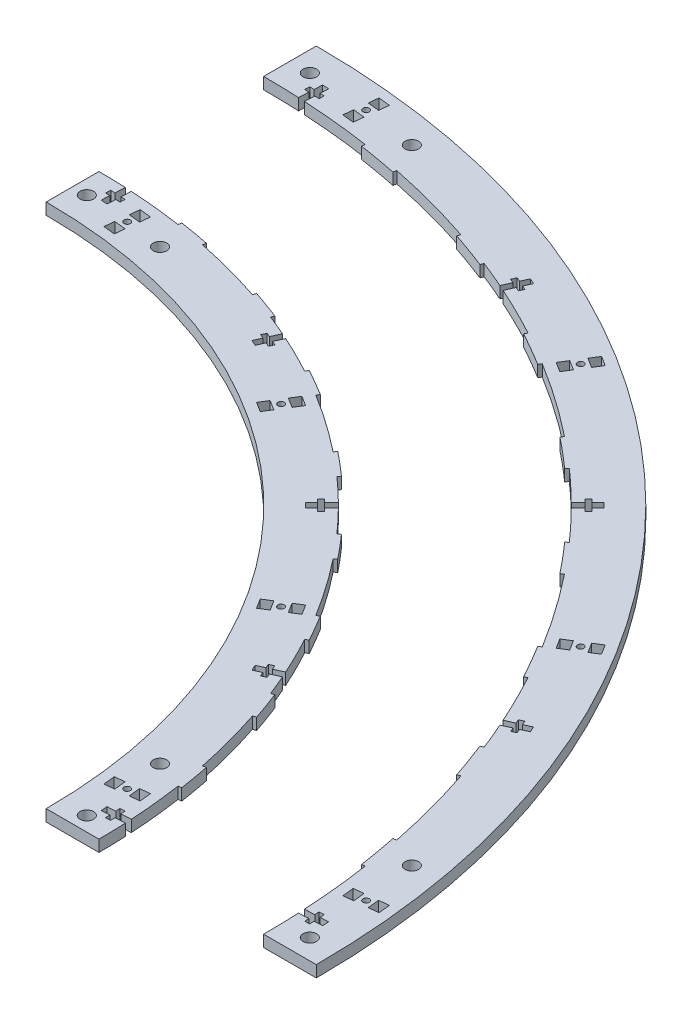
from build123d import *

# Parameters (mm, degrees)
BOSS_EXTRUDE1_DEPTH = 5.588
CUT_EXTRUDE2_DEPTH  = 543.234577659
CIRPATTERN1_COUNT   = 36
SKETCH8_R           = 1.524
CUT_EXTRUDE3_DEPTH  = 543.234577659
CIRPATTERN3_COUNT   = 4
CIRPATTERN3_ANGLE   = 78
SKETCH11_R          = 356.409886184
SKETCH11_R_2        = 280.209886184
CUT_EXTRUDE7_DEPTH  = 543.234577659
CUT_EXTRUDE16_DEPTH = 10
CUT_EXTRUDE17_DEPTH = 10
CIRPATTERN9_COUNT   = 5
CIRPATTERN9_ANGLE   = 84
CIRPATTERN11_COUNT  = 5
CIRPATTERN11_ANGLE  = 84
CUT_EXTRUDE14_DEPTH = 543.234577659
SKETCH14_R          = 3.2639
CUT_EXTRUDE18_DEPTH = 543.234577659


with BuildPart() as part:
    # Sketch2 → Boss-Extrude1 (new body)
    with BuildSketch(Plane(origin=(0, 0, 0), x_dir=(1, 0, 0), z_dir=(0, 1, 0))):
        with BuildLine():
            Line((0, 383.397386184), (0, 253.222386184))
            ThreePointArc((0, 253.222386184), (179.055266419, 179.055266419), (253.222386184, 0))
            Line((253.222386184, 0), (383.397386184, 0))
            ThreePointArc((383.397386184, 0), (271.10289166, 271.10289166), (0, 383.397386184))
        make_face()
    extrude(amount=BOSS_EXTRUDE1_DEPTH)

    # Sketch3 → Cut-Extrude2 (cut, through all)
    with BuildSketch(Plane(origin=(0, 0, 0), x_dir=(1, 0, 0), z_dir=(0, 1, 0))):
        with BuildLine():
            Line((277.132022507, 41.41765827), (275.561959824, 41.183010829))
            ThreePointArc((275.561959824, 41.183010829), (277.562143886, 24.283541014), (278.526909251, 7.293483801))
            Line((278.526909251, 7.293483801), (280.113865254, 7.335039706))
            ThreePointArc((280.113865254, 7.335039706), (279.143602969, 24.421900756), (277.132022507, 41.41765827))
        make_face()
        with BuildLine():
            Line((354.065093978, 52.915382838), (352.495031295, 52.680735398))
            ThreePointArc((352.495031295, 52.680735398), (355.053638964, 31.063168353), (356.287753417, 9.329723167))
            Line((356.287753417, 9.329723167), (357.874709421, 9.371279072))
            ThreePointArc((357.874709421, 9.371279072), (356.635098047, 31.201528095), (354.065093978, 52.915382838))
        make_face()
    cut_extrude2 = extrude(amount=CUT_EXTRUDE2_DEPTH, mode=Mode.SUBTRACT)

    # CirPattern1: Cut-Extrude2 ×36 about axis
    cirpattern1_axis = Axis((0, 0, 0), (0, 1, 0))
    for i in range(1, CIRPATTERN1_COUNT):
        add(cut_extrude2.rotate(cirpattern1_axis, i * 360 / CIRPATTERN1_COUNT), mode=Mode.SUBTRACT)

    # Sketch8 → Cut-Extrude3 (cut, through all)
    with BuildSketch(Plane(origin=(0, 0, 0), x_dir=(1, 0, 0), z_dir=(0, 1, 0))):
        with Locations((264.465635528, 27.796458376)):
            Circle(SKETCH8_R)
        with Locations((368.666667116, 38.748428115)):
            Circle(SKETCH8_R)
        Polygon((256.86367051, 24.188069523), (261.600081037, 24.68588633), (261.015975984, 30.243274681), (256.279565458, 29.745457875), align=None)
        Polygon((361.064702097, 35.140039262), (365.801112624, 35.637856069), (365.217007571, 41.19524442), (360.480597045, 40.697427614), align=None)
        Polygon((267.915295073, 25.349642071), (272.651705599, 25.847458878), (272.067600546, 31.404847229), (267.33119002, 30.907030423), align=None)
        Polygon((372.11632666, 36.30161181), (376.852737186, 36.799428617), (376.268632134, 42.356816968), (371.532221607, 41.859000162), align=None)
    cut_extrude3 = extrude(amount=CUT_EXTRUDE3_DEPTH, mode=Mode.SUBTRACT)

    # CirPattern3: Cut-Extrude3 ×4 about axis
    cirpattern3_axis = Axis((0, 0, 0), (0, 1, 0))
    for i in range(1, CIRPATTERN3_COUNT):
        add(cut_extrude3.rotate(cirpattern3_axis, i * CIRPATTERN3_ANGLE / (CIRPATTERN3_COUNT - 1)), mode=Mode.SUBTRACT)

    # Sketch11 → Cut-Extrude7 (cut, through all)
    with BuildSketch(Plane(origin=(0, 0, 0), x_dir=(1, 0, 0), z_dir=(0, 1, 0))):
        Circle(SKETCH11_R)
        Circle(SKETCH11_R_2, mode=Mode.SUBTRACT)
    extrude(amount=CUT_EXTRUDE7_DEPTH, mode=Mode.SUBTRACT)


with BuildPart() as cut_extrude7_piece_1:
    # of the separate pieces the step leaves, piece 1, a body of its own (cut_extrude7_pieces)
    add(part.part.solids().sort_by_distance((0, 0, -383.397386184))[0])

    # Sketch12 → Cut-Extrude16 (cut)
    with BuildSketch(Plane(origin=(0, 0, 0), x_dir=(1, 0, 0), z_dir=(0, 1, 0))):
        Polygon((362.451355257, 15.324065158), (364.829341837, 15.448690154), (364.717229101, 17.587928588), (368.680540067, 17.795636915), (368.521020073, 20.839459736), (364.557709107, 20.63175141), (364.445596371, 22.770989844), (362.067609791, 22.646364848), (362.179722527, 20.507126414), (355.838424981, 20.174793092), (355.997944976, 17.13097027), (362.339242522, 17.463303592), align=None)
    cut_extrude16 = extrude(amount=CUT_EXTRUDE16_DEPTH, mode=Mode.SUBTRACT)

    # CirPattern9: Cut-Extrude16 ×5 about axis
    cirpattern9_axis = Axis((0, 0, 0), (0, 1, 0))
    for i in range(1, CIRPATTERN9_COUNT):
        add(cut_extrude16.rotate(cirpattern9_axis, i * CIRPATTERN9_ANGLE / (CIRPATTERN9_COUNT - 1)), mode=Mode.SUBTRACT)


with BuildPart() as cut_extrude7_piece_2:
    # of the separate pieces the step leaves, piece 2, a body of its own (cut_extrude7_pieces)
    add(part.part.solids().sort_by_distance((0, 0, -280.209886184))[0])

    # Sketch12<6> → Cut-Extrude17 (cut)
    with BuildSketch(Plane(origin=(0, 0, 0), x_dir=(1, 0, 0), z_dir=(0, 1, 0))):
        Polygon((271.29431818, 10.546727279), (273.672304759, 10.671352275), (273.560192023, 12.810590709), (279.901489569, 13.142924031), (279.741969575, 16.186746853), (273.400672029, 15.854413531), (273.288559293, 17.993651965), (270.910572714, 17.869026969), (271.022685449, 15.729788535), (267.059374483, 15.522080209), (267.218894478, 12.478257387), (271.182205444, 12.685965713), align=None)
    cut_extrude17 = extrude(amount=CUT_EXTRUDE17_DEPTH, mode=Mode.SUBTRACT)

    # CirPattern11: Cut-Extrude17 ×5 about axis
    cirpattern11_axis = Axis((0, 0, 0), (0, 1, 0))
    for i in range(1, CIRPATTERN11_COUNT):
        add(cut_extrude17.rotate(cirpattern11_axis, i * CIRPATTERN11_ANGLE / (CIRPATTERN11_COUNT - 1)), mode=Mode.SUBTRACT)


with BuildPart() as cut_extrude14_tool:
    # Sketch13 → Cut-Extrude14 (new, through all)
    with BuildSketch(Plane(origin=(0, 0, 0), x_dir=(1, 0, 0), z_dir=(0, 1, 0))):
        with BuildLine():
            Line((278.526909251, 7.293483801), (280.113865254, 7.335039706))
            ThreePointArc((280.113865254, 7.335039706), (280.185879923, 3.667834085), (280.209886184, 0))
            Line((280.209886184, 0), (278.622386184, 0))
            ThreePointArc((278.622386184, 0), (278.598515928, 3.647054352), (278.526909251, 7.293483801))
        make_face()
        with BuildLine():
            Line((357.874709421, 9.371279072), (356.287753417, 9.329723167))
            ThreePointArc((356.287753417, 9.329723167), (356.379351684, 4.665261268), (356.409886184, 0))
            Line((356.409886184, 0), (357.997386184, 0))
            ThreePointArc((357.997386184, 0), (357.966715679, 4.686041001), (357.874709421, 9.371279072))
        make_face()
        with BuildLine():
            Line((0, 357.997386184), (0, 356.409886184))
            ThreePointArc((0, 356.409886184), (4.665261268, 356.379351684), (9.329723167, 356.287753417))
            Line((9.329723167, 356.287753417), (9.371279072, 357.874709421))
            ThreePointArc((9.371279072, 357.874709421), (4.686041001, 357.966715679), (0, 357.997386184))
        make_face()
        with BuildLine():
            Line((0, 280.209886184), (0, 278.622386184))
            ThreePointArc((0, 278.622386184), (3.647054352, 278.598515928), (7.293483801, 278.526909251))
            Line((7.293483801, 278.526909251), (7.335039706, 280.113865254))
            ThreePointArc((7.335039706, 280.113865254), (3.667834085, 280.185879923), (0, 280.209886184))
        make_face()
    extrude(amount=CUT_EXTRUDE14_DEPTH)


with BuildPart() as cut_extrude7_piece_1_1:
    add(cut_extrude7_piece_1.part)

    # Cut-Extrude14: cut by cut_extrude14_tool
    add(cut_extrude14_tool.part, mode=Mode.SUBTRACT)


with BuildPart() as cut_extrude7_piece_2_1:
    add(cut_extrude7_piece_2.part)

    # Cut-Extrude14: cut by cut_extrude14_tool
    add(cut_extrude14_tool.part, mode=Mode.SUBTRACT)


with BuildPart() as cut_extrude18_tool:
    # Sketch14 → Cut-Extrude18 (new, through all)
    with BuildSketch(Plane(origin=(0, 0, 0), x_dir=(1, 0, 0), z_dir=(0, 1, 0))):
        with Locations((265.831261224, 6.961036557)):
            Circle(SKETCH14_R)
        with Locations((370.570357448, 9.703726316)):
            Circle(SKETCH14_R)
        with Locations((365.065659935, 64.370925577)):
            Circle(SKETCH14_R)
        with Locations((261.882427613, 46.176937762)):
            Circle(SKETCH14_R)
        with Locations((46.176937762, 261.882427613)):
            Circle(SKETCH14_R)
        with Locations((64.370925577, 365.065659935)):
            Circle(SKETCH14_R)
        with Locations((9.703726316, 370.570357448)):
            Circle(SKETCH14_R)
        with Locations((6.961036557, 265.831261224)):
            Circle(SKETCH14_R)
    extrude(amount=CUT_EXTRUDE18_DEPTH)


with BuildPart() as cut_extrude7_piece_1_2:
    add(cut_extrude7_piece_1_1.part)

    # Cut-Extrude18: cut by cut_extrude18_tool
    add(cut_extrude18_tool.part, mode=Mode.SUBTRACT)


with BuildPart() as cut_extrude7_piece_2_2:
    add(cut_extrude7_piece_2_1.part)

    # Cut-Extrude18: cut by cut_extrude18_tool
    add(cut_extrude18_tool.part, mode=Mode.SUBTRACT)


solid = Compound([cut_extrude7_piece_1_2.part, cut_extrude7_piece_2_2.part])
